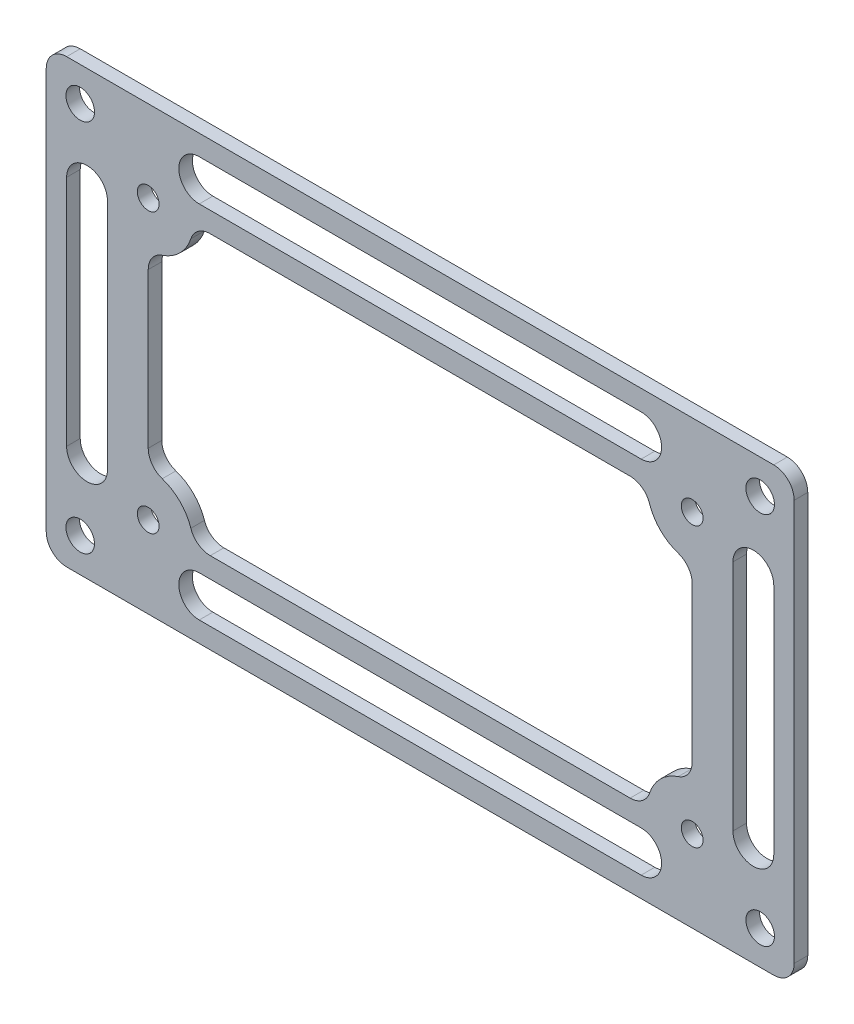
from build123d import *

# Parameters (mm, degrees)
SKETCH_1_W          = 110
SKETCH_1_H          = 65
SKETCH_1_R          = 1.6
SKETCH_1_R_2        = 2.1
EXTRUDE_1_DEPTH     = 2
CUT_EXTRUDE_1_DEPTH = 64.915960448
FILLET_1_R          = 3.005


with BuildPart() as part:
    # ｽｹｯﾁ1 → ﾎﾞｽ - 押し出し1 (new body)
    with BuildSketch(Plane.XY):
        Rectangle(SKETCH_1_W, SKETCH_1_H)
        with Locations((40, 20.5)):
            Circle(SKETCH_1_R, mode=Mode.SUBTRACT)
        with Locations(Location((-40, 20.5, 0), (0, 0, 180))):
            Circle(SKETCH_1_R, mode=Mode.SUBTRACT)
        with Locations((-40, -20.5)):
            Circle(SKETCH_1_R, mode=Mode.SUBTRACT)
        with Locations(Location((40, -20.5, 0), (0, 0, 180))):
            Circle(SKETCH_1_R, mode=Mode.SUBTRACT)
        with Locations((50, 27.5)):
            Circle(SKETCH_1_R_2, mode=Mode.SUBTRACT)
        with Locations(Location((50, -27.5, 0), (0, 0, 180))):
            Circle(SKETCH_1_R_2, mode=Mode.SUBTRACT)
        with Locations(Location((-50, 27.5, 0), (0, 0, 180))):
            Circle(SKETCH_1_R_2, mode=Mode.SUBTRACT)
        with Locations((-50, -27.5)):
            Circle(SKETCH_1_R_2, mode=Mode.SUBTRACT)
    extrude(amount=EXTRUDE_1_DEPTH)

    # ｽｹｯﾁ3 → ｶｯﾄ - 押し出し1 (cut, through all)
    with BuildSketch(Plane.XY.offset(2)):
        with BuildLine():
            Line((-40, -13.9), (-40, 13.9))
            ThreePointArc((-40, 13.9), (-35.333095244, 15.833095244), (-33.4, 20.5))
            Line((-33.4, 20.5), (33.4, 20.5))
            ThreePointArc((33.4, 20.5), (35.333095244, 15.833095244), (40, 13.9))
            Line((40, 13.9), (40, -13.9))
            ThreePointArc((40, -13.9), (35.333095244, -15.833095244), (33.4, -20.5))
            Line((33.4, -20.5), (-33.4, -20.5))
            ThreePointArc((-33.4, -20.5), (-35.333095244, -15.833095244), (-40, -13.9))
        make_face()
        with BuildLine():
            Line((-32.49560129, 29.5), (32.49560129, 29.5))
            ThreePointArc((32.49560129, 29.5), (35.50060129, 26.495), (32.49560129, 23.49))
            Line((32.49560129, 23.49), (-32.49560129, 23.49))
            ThreePointArc((-32.49560129, 23.49), (-35.50060129, 26.495), (-32.49560129, 29.5))
        make_face()
        with BuildLine():
            Line((-32.49560129, -29.5), (32.49560129, -29.5))
            ThreePointArc((32.49560129, -29.5), (35.50060129, -26.495), (32.49560129, -23.49))
            Line((32.49560129, -23.49), (-32.49560129, -23.49))
            ThreePointArc((-32.49560129, -23.49), (-35.50060129, -26.495), (-32.49560129, -29.5))
        make_face()
        with BuildLine():
            Line((52, 17.131617599), (52, -17.131617599))
            ThreePointArc((52, -17.131617599), (48.995, -20.136617599), (45.99, -17.131617599))
            Line((45.99, -17.131617599), (45.99, 17.131617599))
            ThreePointArc((45.99, 17.131617599), (48.995, 20.136617599), (52, 17.131617599))
        make_face()
        with BuildLine():
            Line((-52, 17.131617599), (-52, -17.131617599))
            ThreePointArc((-52, -17.131617599), (-48.995, -20.136617599), (-45.99, -17.131617599))
            Line((-45.99, -17.131617599), (-45.99, 17.131617599))
            ThreePointArc((-45.99, 17.131617599), (-48.995, 20.136617599), (-52, 17.131617599))
        make_face()
    extrude(amount=-CUT_EXTRUDE_1_DEPTH, mode=Mode.SUBTRACT)

    # ﾌｨﾚｯﾄ1
    fillet_1_edges = [part.edges().sort_by_distance(p)[0] for p in [
        (55, -32.5, 1),
        (-55, -32.5, 1),
        (-55, 32.5, 1),
        (55, 32.5, 1),
        (-33.4, -20.5, 1),
        (-40, -13.9, 1),
        (-40, 13.9, 1),
        (-33.4, 20.5, 1),
        (33.4, 20.5, 1),
        (40, 13.9, 1),
        (40, -13.9, 1),
        (33.4, -20.5, 1),
    ]]
    fillet(fillet_1_edges, radius=FILLET_1_R)


solid = part.part
